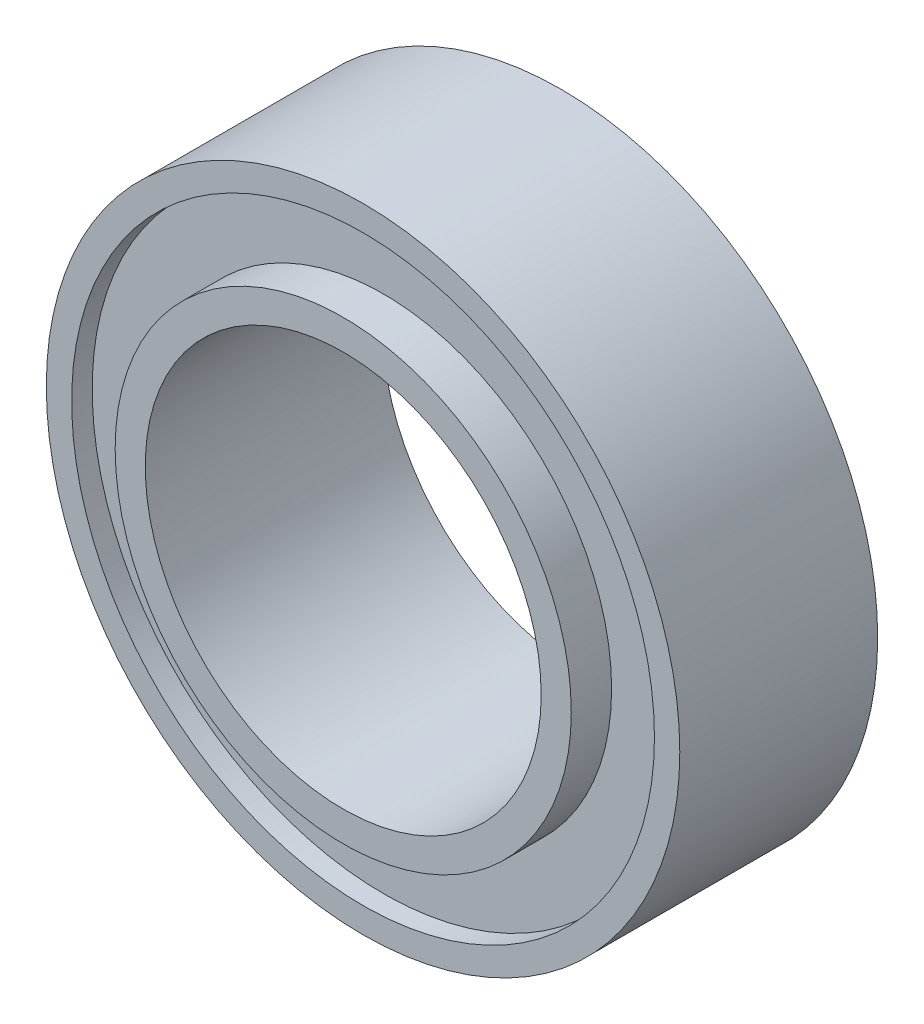
from build123d import *

# Parameters (mm, degrees)
SKETCH1_R                = 6.35
SKETCH1_R_2              = 5.842
BOSS_EXTRUDE1_DEPTH      = 3.96748
BOSS_EXTRUDE2_DEPTH      = 4.36499
BOSS_EXTRUDE2_DEPTH_BACK = 0.39751
SKETCH1_3_R              = 4.572
SKETCH1_3_R_2            = 3.96875
BOSS_EXTRUDE3_START      = 0.41148
SKETCH1_4_R              = 5.842
SKETCH1_4_R_2            = 4.572
BOSS_EXTRUDE3_DEPTH      = 3.14452


with BuildPart() as part:
    # Sketch1 → Boss-Extrude1 (new body)
    with BuildSketch(Plane.XY):
        Circle(SKETCH1_R)
        Circle(SKETCH1_R_2, mode=Mode.SUBTRACT)
    extrude(amount=BOSS_EXTRUDE1_DEPTH)



with BuildPart() as body_2:
    # Sketch1<3> → Boss-Extrude2 (new, two sides: drawn at the far end of the back side and taken through both)
    with BuildSketch(Plane.XY.offset(-BOSS_EXTRUDE2_DEPTH_BACK)):
        Circle(SKETCH1_3_R)
        Circle(SKETCH1_3_R_2, mode=Mode.SUBTRACT)
    extrude(amount=BOSS_EXTRUDE2_DEPTH + BOSS_EXTRUDE2_DEPTH_BACK)


with BuildPart() as part_1:
    add(part.part)

    add(body_2.part)  # Boss-Extrude3 merges body 2
    # Sketch1<4> → Boss-Extrude3 (add)
    with BuildSketch(Plane.XY.offset(BOSS_EXTRUDE3_START)):
        Circle(SKETCH1_4_R)
        Circle(SKETCH1_4_R_2, mode=Mode.SUBTRACT)
    extrude(amount=BOSS_EXTRUDE3_DEPTH)


solid = part_1.part
